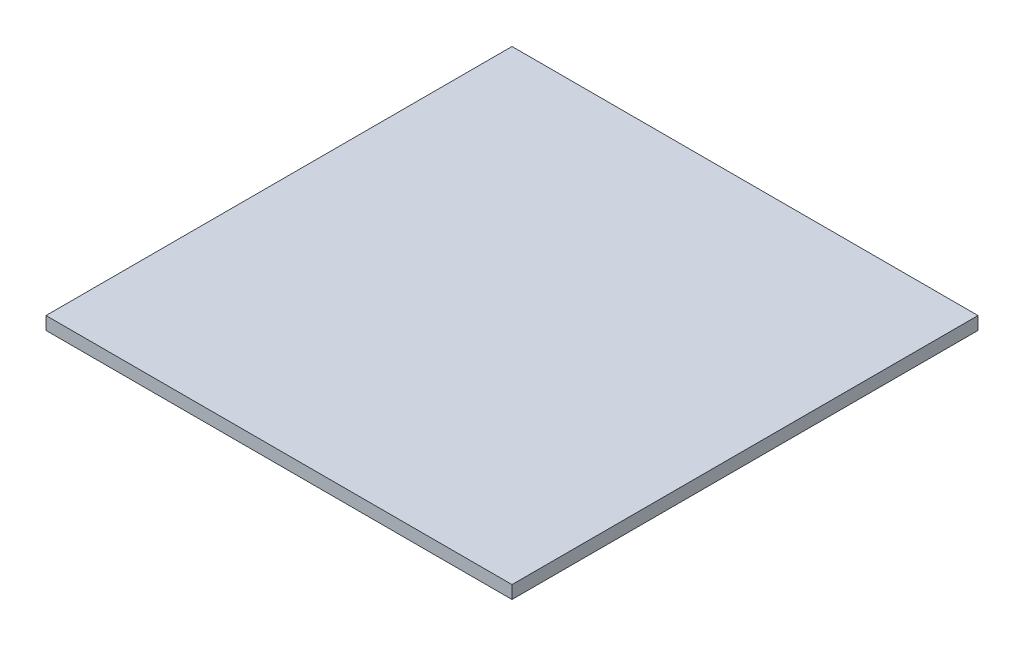
from build123d import *

# Parameters (mm, degrees)
SKETCH1_W           = 914.4
SKETCH1_H           = 25.4
BOSS_EXTRUDE1_DEPTH = 457.2


with BuildPart() as part:
    # Sketch1 → Boss-Extrude1 (new, symmetric)
    with BuildSketch(Plane.XY):
        Rectangle(SKETCH1_W, SKETCH1_H)
    extrude(amount=BOSS_EXTRUDE1_DEPTH, both=True)


solid = part.part
